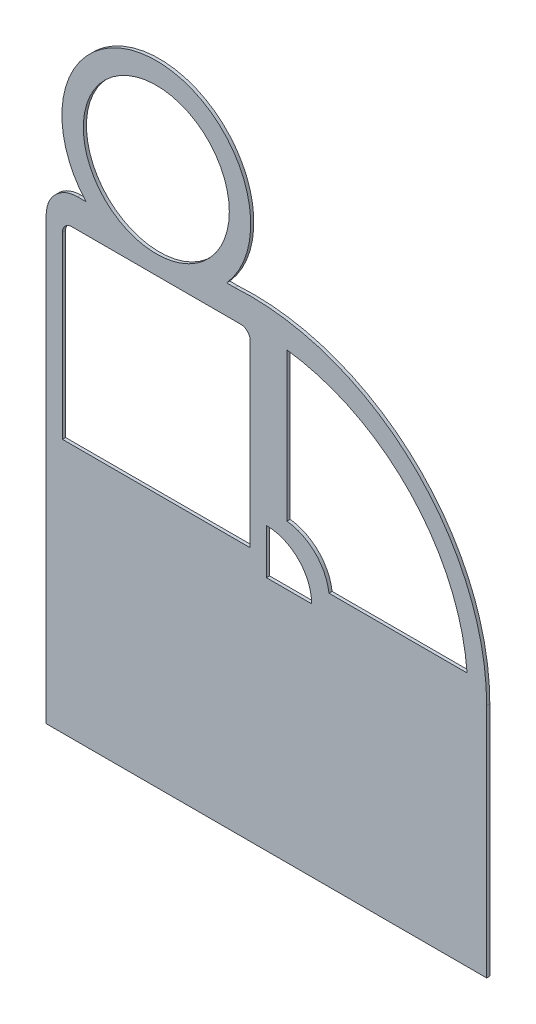
from build123d import *

# Parameters (mm, degrees)
SKETCH1_R           = 232.012436726
BOSS_EXTRUDE2_DEPTH = 10


with BuildPart() as part:
    # Sketch1 → Boss-Extrude2 (new body)
    with BuildSketch(Plane.XY):
        with BuildLine():
            Line((846.568769473, -512.108653834), (820.175567223, -512.108653834))
            ThreePointArc((820.175567223, -512.108653834), (596.568769473, -12.108653834), (372.961971723, -512.108653834))
            Line((372.961971723, -512.108653834), (346.568769473, -512.108653834))
            ThreePointArc((346.568769473, -512.108653834), (275.858091355, -541.397975715), (246.568769473, -612.108653834))
            Line((246.568769473, -612.108653834), (246.568769473, -1812.108653834))
            Line((246.568769473, -1812.108653834), (246.568769473, -2012.242939545))
            Line((246.568769473, -2012.242939545), (946.568769473, -2012.242939545))
            Line((946.568769473, -2012.242939545), (1646.568769473, -2012.242939545))
            Line((1646.568769473, -2012.242939545), (1646.568769473, -1812.108653834))
            Line((1646.568769473, -1812.108653834), (1646.568769473, -1262.242939545))
            ThreePointArc((1646.568769473, -1262.242939545), (1409.039966295, -713.90421061), (846.568769473, -512.108653834))
        make_face()
        with BuildLine():
            Line((946.568769473, -1260.416440178), (946.568769473, -1116.807153033))
            ThreePointArc((946.568769473, -1116.807153033), (1048.115870255, -1158.869339396), (1090.178056619, -1260.416440178))
            Line((1090.178056619, -1260.416440178), (946.568769473, -1260.416440178))
        make_face(mode=Mode.SUBTRACT)
        with BuildLine():
            ThreePointArc((298.257173598, -633.714224791), (307.043970163, -612.501021355), (328.257173598, -603.714224791))
            Line((328.257173598, -603.714224791), (864.880365349, -603.714224791))
            ThreePointArc((864.880365349, -603.714224791), (886.093568784, -612.501021355), (894.880365349, -633.714224791))
            Line((894.880365349, -633.714224791), (894.880365349, -1203.714224791))
            Line((894.880365349, -1203.714224791), (298.257173598, -1203.714224791))
            Line((298.257173598, -1203.714224791), (298.257173598, -633.714224791))
        make_face(mode=Mode.SUBTRACT)
        with Locations((596.568769473, -312.108653834)):
            Circle(SKETCH1_R, mode=Mode.SUBTRACT)
        with BuildLine():
            Line((1012.065009988, -1072.068666538), (1012.065009988, -600.862482616))
            ThreePointArc((1012.065009988, -600.862482616), (1405.330319639, -800.571245417), (1584.263077669, -1203.714224791))
            Line((1584.263077669, -1203.714224791), (1145.378172354, -1203.714224791))
            ThreePointArc((1145.378172354, -1203.714224791), (1101.465382273, -1114.859550352), (1012.065009988, -1072.068666538))
        make_face(mode=Mode.SUBTRACT)
    extrude(amount=-BOSS_EXTRUDE2_DEPTH)


solid = part.part
